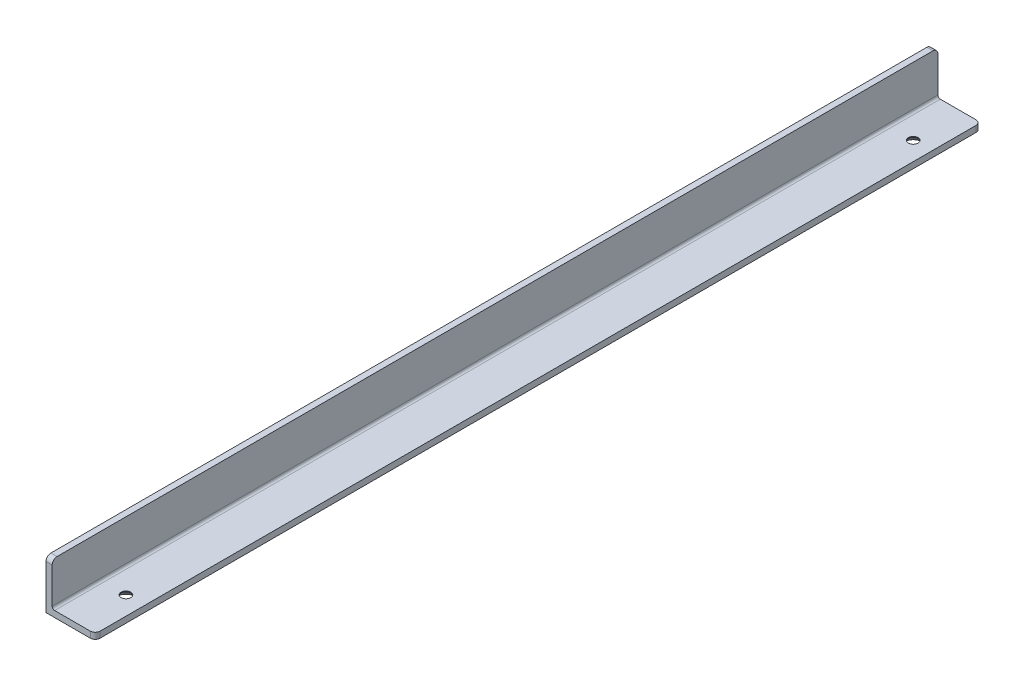
from build123d import *

# Parameters (mm, degrees)
BOSS_EXTRUDE1_DEPTH = 228.6
FILLET1_R           = 2.54


with BuildPart() as part:
    # Sketch1 → Boss-Extrude1 (new, symmetric)
    with BuildSketch(Plane.XY):
        with BuildLine():
            Line((0, 0), (25.4, 0))
            Line((25.4, 0), (25.4, 3.175))
            Line((25.4, 3.175), (4.445, 3.175))
            ThreePointArc((4.445, 3.175), (3.546974388, 3.546974388), (3.175, 4.445))
            Line((3.175, 4.445), (3.175, 25.400000027))
            Line((3.175, 25.400000027), (0, 25.400000027))
            Line((0, 25.400000027), (0, 0))
        make_face()
    extrude(amount=BOSS_EXTRUDE1_DEPTH, both=True)

    # Sketch3 → CSK for #10 Flat Head Machine Screw1 (revolve, cut)
    with BuildSketch(Plane(origin=(15.875, 0, -203.2), x_dir=(0, 0, -1), z_dir=(1, 0, 0))):
        Polygon((0, 0), (0, 3.175), (2.4892, 3.175), (2.4892, 2.761229288), (4.8895, 0), align=None)
    csk_for_10_flat_head_machine_screw1 = revolve(axis=Axis((15.875, -6.35, -203.2), (0, 1, 0)), mode=Mode.SUBTRACT)

    # Mirror1: CSK for #10 Flat Head Machine Screw1 across plane
    add(csk_for_10_flat_head_machine_screw1.mirror(Plane.XY), mode=Mode.SUBTRACT)

    # Fillet1
    fillet1_edges = [part.edges().sort_by_distance(p)[0] for p in [
        (25.4, 1.5875, 228.6),
        (1.5875, 25.400000027, 228.6),
        (1.5875, 25.400000027, -228.6),
        (25.4, 1.5875, -228.6),
    ]]
    fillet(fillet1_edges, radius=FILLET1_R)


solid = part.part
